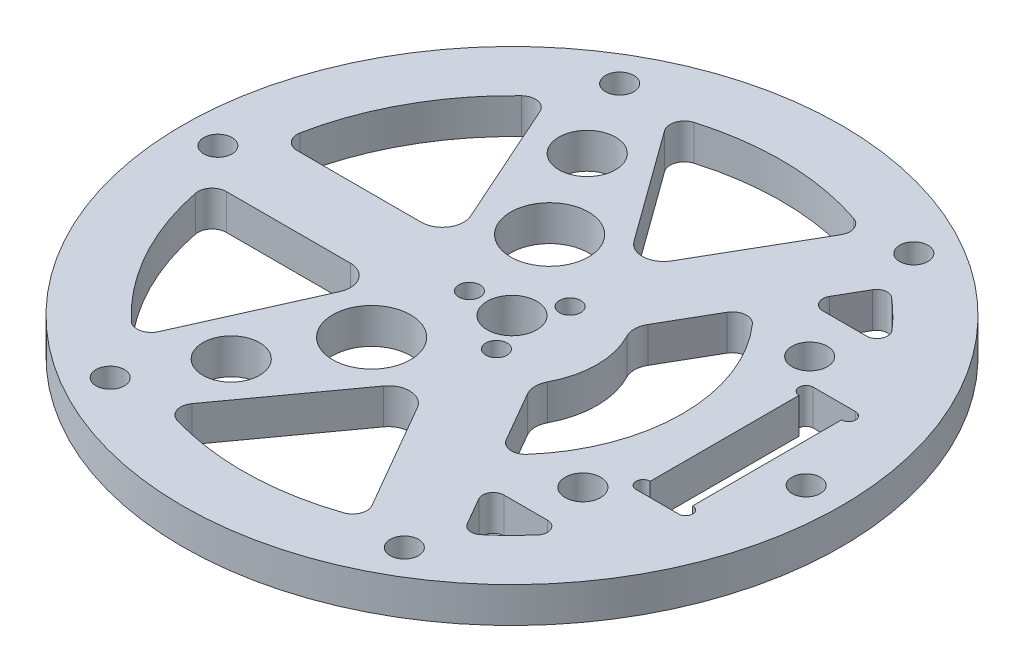
from build123d import *

# Parameters (mm, degrees)
SKETCH_1_R                = 46.5
SKETCH_1_R_2              = 2
SKETCH_1_R_3              = 3.5
SKETCH_1_R_4              = 2.5
SKETCH_1_R_5              = 4
SKETCH_1_R_6              = 1.5
SKETCH_1_W                = 6
SKETCH_1_H                = 25
EXTRUDE_1_DEPTH           = 5
HOLE_WIZARD_1_D           = 3
HOLE_WIZARD_1_CSINK_D     = 6
HOLE_WIZARD_1_CSINK_ANGLE = 90
HOLE_WIZARD_2_D           = 4
HOLE_WIZARD_2_CSINK_D     = 8
HOLE_WIZARD_2_CSINK_ANGLE = 90
SKETCH_4_R                = 1
CUT_EXTRUDE_1_DEPTH       = 66.9507392
SKETCH_5_R                = 5.5
CUT_EXTRUDE_2_DEPTH       = 66.9507392
FILLET_1_R                = 2
FILLET_2_R                = 3
FILLET_3_R                = 1.5


with BuildPart() as part:
    # 草图1 → 凸台-拉伸1 (new body)
    with BuildSketch(Plane(origin=(0, 0, 0), x_dir=(1, 0, 0), z_dir=(0, 1, 0))):
        with Locations(Location((0, 0, 0), (0, 0, 270))):
            Circle(SKETCH_1_R)
        with Locations(Location((-20.75, 35.940054257, 0), (0, 0, 270))):
            Circle(SKETCH_1_R_2, mode=Mode.SUBTRACT)
        with Locations(Location((20.75, 35.940054257, 0), (0, 0, 270))):
            Circle(SKETCH_1_R_2, mode=Mode.SUBTRACT)
        with Locations(Location((41.5, 0, 0), (0, 0, 270))):
            Circle(SKETCH_1_R_2, mode=Mode.SUBTRACT)
        with Locations(Location((20.75, -35.940054257, 0), (0, 0, 270))):
            Circle(SKETCH_1_R_2, mode=Mode.SUBTRACT)
        with Locations(Location((0, 0, 0), (0, 0, 270))):
            Circle(SKETCH_1_R_3, mode=Mode.SUBTRACT)
        with Locations(Location((-20.75, -35.940054257, 0), (0, 0, 270))):
            Circle(SKETCH_1_R_2, mode=Mode.SUBTRACT)
        with Locations(Location((-41.5, 0, 0), (0, 0, 270))):
            Circle(SKETCH_1_R_2, mode=Mode.SUBTRACT)
        with Locations(Location((26, 16, 0), (0, 0, 270))):
            Circle(SKETCH_1_R_4, mode=Mode.SUBTRACT)
        with Locations(Location((26, -16, 0), (0, 0, 270))):
            Circle(SKETCH_1_R_4, mode=Mode.SUBTRACT)
        with Locations(Location((-14.5, 25.11473671, 0), (0, 0, 270))):
            Circle(SKETCH_1_R_5, mode=Mode.SUBTRACT)
        with Locations(Location((-6, 0, 0), (0, 0, 270))):
            Circle(SKETCH_1_R_6, mode=Mode.SUBTRACT)
        with Locations(Location((3, 5.196152423, 0), (0, 0, 270))):
            Circle(SKETCH_1_R_6, mode=Mode.SUBTRACT)
        with Locations(Location((3, -5.196152423, 0), (0, 0, 270))):
            Circle(SKETCH_1_R_6, mode=Mode.SUBTRACT)
        with Locations(Location((-14.5, -25.11473671, 0), (0, 0, 270))):
            Circle(SKETCH_1_R_5, mode=Mode.SUBTRACT)
        with Locations((33, 0)):
            Rectangle(SKETCH_1_W, SKETCH_1_H, mode=Mode.SUBTRACT)
    extrude(amount=EXTRUDE_1_DEPTH)

    # 孔1 (through all)
    with Locations(Plane(origin=(0, 0, 0), x_dir=(-1, 0, 0), z_dir=(0, -1, 0))):
        with Locations((-3, 5.196152423), (6, 0), (-3, -5.196152423)):
            CounterSinkHole(HOLE_WIZARD_1_D / 2, HOLE_WIZARD_1_CSINK_D / 2, counter_sink_angle=HOLE_WIZARD_1_CSINK_ANGLE)

    # 孔2 (through all)
    with Locations(Plane(origin=(0, 0, 0), x_dir=(-1, 0, 0), z_dir=(0, -1, 0))):
        with Locations((-41.5, 0), (-20.75, 35.940054257), (20.75, 35.940054257), (41.5, 0), (20.75, -35.940054257), (-20.75, -35.940054257)):
            CounterSinkHole(HOLE_WIZARD_2_D / 2, HOLE_WIZARD_2_CSINK_D / 2, counter_sink_angle=HOLE_WIZARD_2_CSINK_ANGLE)

    # 草图4 → 切除-拉伸1 (cut, through all)
    with BuildSketch(Plane(origin=(0, 5, 0), x_dir=(1, 0, 0), z_dir=(0, 1, 0))):
        with Locations((30, 11.5)):
            Circle(SKETCH_4_R)
        with Locations((30, -11.5)):
            Circle(SKETCH_4_R)
        with Locations((36, -11.5)):
            Circle(SKETCH_4_R)
        with Locations((36, 11.5)):
            Circle(SKETCH_4_R)
    extrude(amount=-CUT_EXTRUDE_1_DEPTH, mode=Mode.SUBTRACT)

    # 草图5 → 切除-拉伸2 (cut, through all)
    with BuildSketch(Plane.XZ):
        with Locations(Location((-7.25, 12.557368355, 0), (0, 0, 270))):
            Circle(SKETCH_5_R)
        with Locations(Location((-7.25, -12.557368355, 0), (0, 0, 90))):
            Circle(SKETCH_5_R)
        with BuildLine():
            Line((-24.078608458, 29.397629407), (-13.184318354, 5))
            Line((-13.184318354, 5), (-37.669616404, 5))
            ThreePointArc((-37.669616404, 5), (-33.196715177, 18.49264993), (-24.078608458, 29.397629407))
        make_face()
        with BuildLine():
            Line((2.262032158, 13.917954626), (14.504681183, 35.122844756))
            ThreePointArc((14.504681183, 35.122844756), (0.583252966, 37.995523631), (-13.419789648, 35.551501316))
            Line((-13.419789648, 35.551501316), (2.262032158, 13.917954626))
        make_face()
        with BuildLine():
            Line((16.081480392, 17.8539411), (9.784483076, 6.947221814))
            ThreePointArc((9.784483076, 6.947221814), (12, 0), (9.784483076, -6.947221814))
            Line((9.784483076, -6.947221814), (16.081480392, -17.8539411))
            ThreePointArc((16.081480392, -17.8539411), (24.028675045, 0), (16.081480392, 17.8539411))
        make_face()
        with BuildLine():
            Line((23.164935221, 30.122844756), (18.763883749, 22.5))
            Line((18.763883749, 22.5), (30.622703996, 22.5))
            ThreePointArc((30.622703996, 22.5), (27.162556464, 26.574339622), (23.164935221, 30.122844756))
        make_face()
        with BuildLine():
            Line((18.763883749, -22.5), (30.622703996, -22.5))
            ThreePointArc((30.622703996, -22.5), (27.162556464, -26.574339622), (23.164935221, -30.122844756))
            Line((23.164935221, -30.122844756), (18.763883749, -22.5))
        make_face()
        with BuildLine():
            Line((2.262032158, -13.917954626), (14.504681183, -35.122844756))
            ThreePointArc((14.504681183, -35.122844756), (0.583252966, -37.995523631), (-13.419789648, -35.551501316))
            Line((-13.419789648, -35.551501316), (2.262032158, -13.917954626))
        make_face()
        with BuildLine():
            Line((-13.184318354, -5), (-37.669616404, -5))
            ThreePointArc((-37.669616404, -5), (-33.196715177, -18.49264993), (-24.078608458, -29.397629407))
            Line((-24.078608458, -29.397629407), (-13.184318354, -5))
        make_face()
    extrude(amount=-CUT_EXTRUDE_2_DEPTH, mode=Mode.SUBTRACT)

    # 圆角1
    fillet_1_edges = [part.edges().sort_by_distance(p)[0] for p in [
        (-13.419789648, 2.5, 35.551501316),
        (14.504681183, 2.5, 35.122844756),
        (16.081480392, 2.5, 17.8539411),
        (16.081480392, 2.5, -17.8539411),
        (-37.669616404, 2.5, 5),
        (-24.078608458, 2.5, 29.397629407),
        (-24.078608458, 2.5, -29.397629407),
        (-37.669616404, 2.5, -5),
        (14.504681183, 2.5, -35.122844756),
        (-13.419789648, 2.5, -35.551501316),
    ]]
    fillet(fillet_1_edges, radius=FILLET_1_R)

    # 圆角2
    fillet_2_edges = [part.edges().sort_by_distance(p)[0] for p in [
        (2.262032158, 2.5, 13.917954626),
        (9.784483076, 2.5, -6.947221814),
        (9.784483076, 2.5, 6.947221814),
        (-13.184318354, 2.5, 5),
        (-13.184318354, 2.5, -5),
        (2.262032158, 2.5, -13.917954626),
    ]]
    fillet(fillet_2_edges, radius=FILLET_2_R)

    # 圆角3
    fillet_3_edges = [part.edges().sort_by_distance(p)[0] for p in [
        (23.164935221, 2.5, 30.122844756),
        (30.622703996, 2.5, 22.5),
        (18.763883749, 2.5, 22.5),
        (23.164935221, 2.5, -30.122844756),
        (18.763883749, 2.5, -22.5),
        (30.622703996, 2.5, -22.5),
    ]]
    fillet(fillet_3_edges, radius=FILLET_3_R)


solid = part.part
